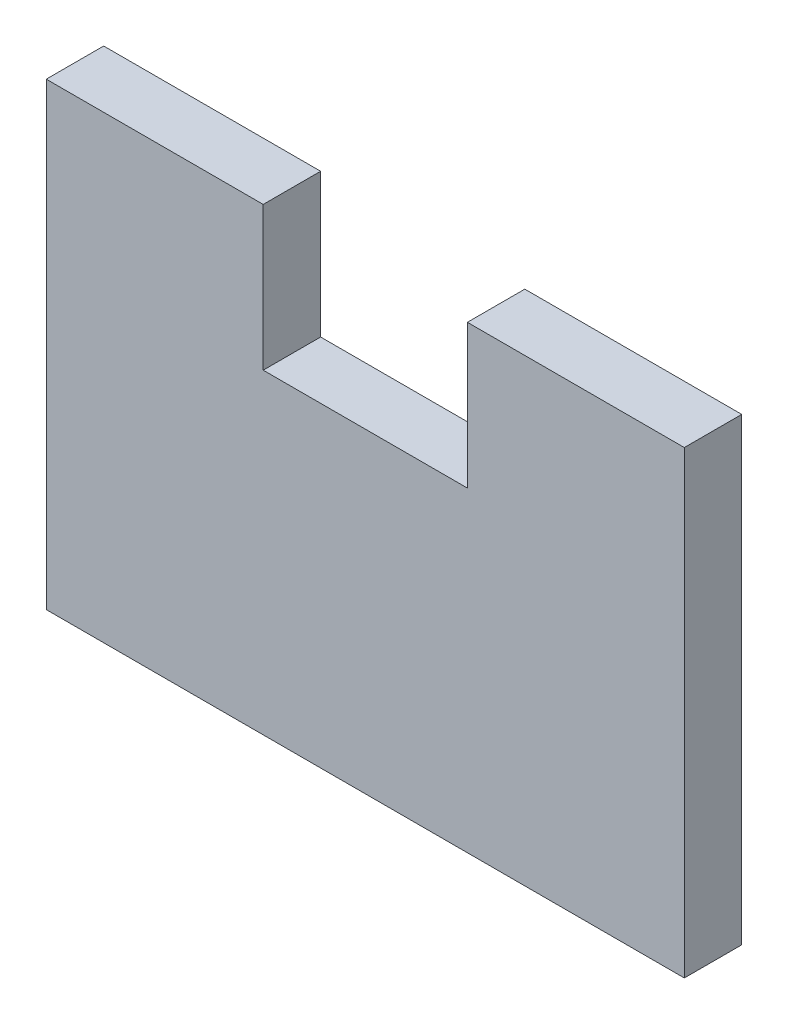
from build123d import *

# Parameters (mm, degrees)
SKETCH1_W           = 200
SKETCH1_H           = 144
BOSS_EXTRUDE1_DEPTH = 18
SKETCH2_W           = 64
SKETCH2_H           = 45
CUT_EXTRUDE1_DEPTH  = 18


with BuildPart() as part:
    # Sketch1 → Boss-Extrude1 (new body)
    with BuildSketch(Plane.XY):
        Rectangle(SKETCH1_W, SKETCH1_H)
    extrude(amount=BOSS_EXTRUDE1_DEPTH)

    # Sketch2 → Cut-Extrude1 (cut)
    with BuildSketch(Plane.XY.offset(18)):
        with Locations((0, 49.5)):
            Rectangle(SKETCH2_W, SKETCH2_H)
    extrude(amount=-CUT_EXTRUDE1_DEPTH, mode=Mode.SUBTRACT)


solid = part.part
